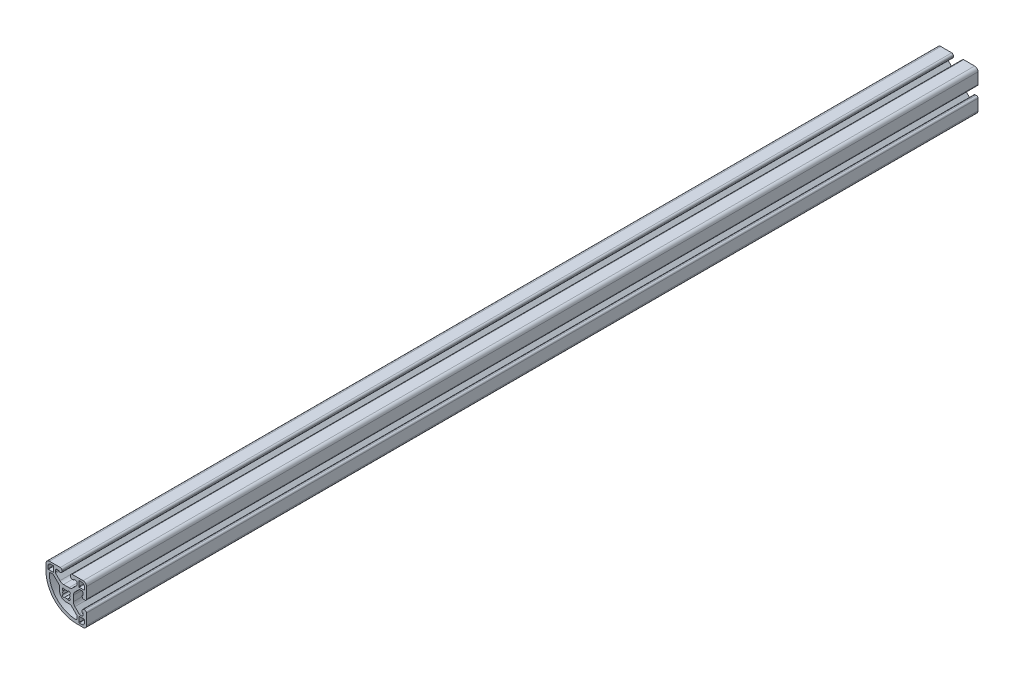
from build123d import *

# Parameters (mm, degrees)
BOSS_EXTRUDE1_DEPTH = 838.2


with BuildPart() as part:
    # Sketch1 → Boss-Extrude1 (new body)
    with BuildSketch(Plane.XY.offset(838.2)):
        with BuildLine():
            Line((-19.05, 15.875), (-19.05, 9.525))
            ThreePointArc((-19.05, 9.525), (-10.680576272, -10.680576272), (9.525, -19.05))
            Line((9.525, -19.05), (15.875, -19.05))
            ThreePointArc((15.875, -19.05), (18.12006403, -18.12006403), (19.05, -15.875))
            Line((19.05, -15.875), (19.05, -5.6388))
            ThreePointArc((19.05, -5.6388), (18.588751759, -4.525248241), (17.4752, -4.064))
            Line((17.4752, -4.064), (16.5608, -4.064))
            ThreePointArc((16.5608, -4.064), (15.447248241, -4.525248241), (14.986, -5.6388))
            Line((14.986, -5.6388), (14.986, -6.476993142))
            ThreePointArc((14.986, -6.476993142), (15.097592316, -6.746400826), (15.367, -6.857993142))
            Line((15.367, -6.857993142), (15.44319365, -6.857993142))
            ThreePointArc((15.44319365, -6.857993142), (15.712601334, -6.969585458), (15.82419365, -7.238993142))
            Line((15.82419365, -7.238993142), (15.82419365, -9.017))
            ThreePointArc((15.82419365, -9.017), (15.452219262, -9.915025612), (14.55419365, -10.287))
            Line((14.55419365, -10.287), (12.968312693, -10.287))
            ThreePointArc((12.968312693, -10.287), (12.482304734, -10.190327006), (12.070287081, -9.915025612))
            Line((12.070287081, -9.915025612), (8.122184211, -5.966922742))
            ThreePointArc((8.122184211, -5.966922742), (7.092556996, -4.425976719), (6.731, -2.608306952))
            Line((6.731, -2.608306952), (6.731, 2.608306952))
            ThreePointArc((6.731, 2.608306952), (7.092556996, 4.425976719), (8.122184211, 5.966922742))
            Line((8.122184211, 5.966922742), (12.070287081, 9.915025612))
            ThreePointArc((12.070287081, 9.915025612), (12.482304734, 10.190327006), (12.968312693, 10.287))
            Line((12.968312693, 10.287), (14.55419365, 10.287))
            ThreePointArc((14.55419365, 10.287), (15.452219262, 9.915025612), (15.82419365, 9.017))
            Line((15.82419365, 9.017), (15.82419365, 7.238993142))
            ThreePointArc((15.82419365, 7.238993142), (15.712601334, 6.969585458), (15.44319365, 6.857993142))
            Line((15.44319365, 6.857993142), (15.367, 6.857993142))
            ThreePointArc((15.367, 6.857993142), (15.097592316, 6.746400826), (14.986, 6.476993142))
            Line((14.986, 6.476993142), (14.986, 5.6388))
            ThreePointArc((14.986, 5.6388), (15.447248241, 4.525248241), (16.5608, 4.064))
            Line((16.5608, 4.064), (17.4752, 4.064))
            ThreePointArc((17.4752, 4.064), (18.588751759, 4.525248241), (19.05, 5.6388))
            Line((19.05, 5.6388), (19.05, 15.875))
            ThreePointArc((19.05, 15.875), (18.12006403, 18.12006403), (15.875, 19.05))
            Line((15.875, 19.05), (5.6388, 19.05))
            ThreePointArc((5.6388, 19.05), (4.525248241, 18.588751759), (4.064, 17.4752))
            Line((4.064, 17.4752), (4.064, 16.5608))
            ThreePointArc((4.064, 16.5608), (4.525248241, 15.447248241), (5.6388, 14.986))
            Line((5.6388, 14.986), (6.476993142, 14.986))
            ThreePointArc((6.476993142, 14.986), (6.746400826, 15.097592316), (6.857993142, 15.367))
            Line((6.857993142, 15.367), (6.857993142, 15.44319365))
            ThreePointArc((6.857993142, 15.44319365), (6.969585458, 15.712601334), (7.238993142, 15.82419365))
            Line((7.238993142, 15.82419365), (9.017, 15.82419365))
            ThreePointArc((9.017, 15.82419365), (9.915025612, 15.452219262), (10.287, 14.55419365))
            Line((10.287, 14.55419365), (10.287, 12.968312693))
            ThreePointArc((10.287, 12.968312693), (10.190327006, 12.482304734), (9.915025612, 12.070287081))
            Line((9.915025612, 12.070287081), (5.966922742, 8.122184211))
            ThreePointArc((5.966922742, 8.122184211), (4.425976719, 7.092556996), (2.608306952, 6.731))
            Line((2.608306952, 6.731), (-2.608306952, 6.731))
            ThreePointArc((-2.608306952, 6.731), (-4.425976719, 7.092556996), (-5.966922742, 8.122184211))
            Line((-5.966922742, 8.122184211), (-9.915025612, 12.070287081))
            ThreePointArc((-9.915025612, 12.070287081), (-10.190327006, 12.482304734), (-10.287, 12.968312693))
            Line((-10.287, 12.968312693), (-10.287, 14.55419365))
            ThreePointArc((-10.287, 14.55419365), (-9.915025612, 15.452219262), (-9.017, 15.82419365))
            Line((-9.017, 15.82419365), (-7.238993142, 15.82419365))
            ThreePointArc((-7.238993142, 15.82419365), (-6.969585458, 15.712601334), (-6.857993142, 15.44319365))
            Line((-6.857993142, 15.44319365), (-6.857993142, 15.367))
            ThreePointArc((-6.857993142, 15.367), (-6.746400826, 15.097592316), (-6.476993142, 14.986))
            Line((-6.476993142, 14.986), (-5.6388, 14.986))
            ThreePointArc((-5.6388, 14.986), (-4.525248241, 15.447248241), (-4.064, 16.5608))
            Line((-4.064, 16.5608), (-4.064, 17.4752))
            ThreePointArc((-4.064, 17.4752), (-4.525248241, 18.588751759), (-5.6388, 19.05))
            Line((-5.6388, 19.05), (-15.875, 19.05))
            ThreePointArc((-15.875, 19.05), (-18.12006403, 18.12006403), (-19.05, 15.875))
        make_face()
        with BuildLine():
            Line((-14.4526, 17.2466), (-12.2428, 17.2466))
            ThreePointArc((-12.2428, 17.2466), (-11.973392316, 17.135007684), (-11.8618, 16.8656))
            Line((-11.8618, 16.8656), (-11.8618, 12.2428))
            ThreePointArc((-11.8618, 12.2428), (-11.973392316, 11.973392316), (-12.2428, 11.8618))
            Line((-12.2428, 11.8618), (-16.8656, 11.8618))
            ThreePointArc((-16.8656, 11.8618), (-17.135007684, 11.973392316), (-17.2466, 12.2428))
            Line((-17.2466, 12.2428), (-17.2466, 14.4526))
            ThreePointArc((-17.2466, 14.4526), (-16.428256347, 16.428256347), (-14.4526, 17.2466))
        make_face(mode=Mode.SUBTRACT)
        with BuildLine():
            Line((-14.726680045, 10.287), (-12.804003164, 10.287))
            ThreePointArc((-12.804003164, 10.287), (-12.463797593, 10.219328904), (-12.175385236, 10.026617928))
            Line((-12.175385236, 10.026617928), (-6.696574388, 4.547807081))
            ThreePointArc((-6.696574388, 4.547807081), (-6.421272994, 4.135789428), (-6.3246, 3.649781469))
            Line((-6.3246, 3.649781469), (-6.3246, 0))
            ThreePointArc((-6.3246, 0), (-4.472167548, -4.472167548), (0, -6.3246))
            Line((0, -6.3246), (3.649781469, -6.3246))
            ThreePointArc((3.649781469, -6.3246), (4.135789428, -6.421272994), (4.547807081, -6.696574388))
            Line((4.547807081, -6.696574388), (10.026617928, -12.175385236))
            ThreePointArc((10.026617928, -12.175385236), (10.219328904, -12.463797593), (10.287, -12.804003164))
            Line((10.287, -12.804003164), (10.287, -14.726680045))
            ThreePointArc((10.287, -14.726680045), (9.905572448, -15.634060343), (8.990403141, -15.996401513))
            ThreePointArc((8.990403141, -15.996401513), (-8.525314803, -8.525314803), (-15.996401513, 8.990403141))
            ThreePointArc((-15.996401513, 8.990403141), (-15.634060343, 9.905572448), (-14.726680045, 10.287))
        make_face(mode=Mode.SUBTRACT)
        with BuildLine():
            Line((-3.437208141, -1.820762039), (-3.017877069, -1.401430967))
            ThreePointArc((-3.017877069, -1.401430967), (-3.3274, 0), (-3.017877069, 1.401430967))
            Line((-3.017877069, 1.401430967), (-3.437208141, 1.820762039))
            ThreePointArc((-3.437208141, 1.820762039), (-3.437208141, 3.437208141), (-1.820762039, 3.437208141))
            Line((-1.820762039, 3.437208141), (-1.401430967, 3.017877069))
            ThreePointArc((-1.401430967, 3.017877069), (0, 3.3274), (1.401430967, 3.017877069))
            Line((1.401430967, 3.017877069), (1.820762039, 3.437208141))
            ThreePointArc((1.820762039, 3.437208141), (3.437208141, 3.437208141), (3.437208141, 1.820762039))
            Line((3.437208141, 1.820762039), (3.017877069, 1.401430967))
            ThreePointArc((3.017877069, 1.401430967), (3.3274, 0), (3.017877069, -1.401430967))
            Line((3.017877069, -1.401430967), (3.437208141, -1.820762039))
            ThreePointArc((3.437208141, -1.820762039), (3.437208141, -3.437208141), (1.820762039, -3.437208141))
            Line((1.820762039, -3.437208141), (1.401430967, -3.017877069))
            ThreePointArc((1.401430967, -3.017877069), (0, -3.3274), (-1.401430967, -3.017877069))
            Line((-1.401430967, -3.017877069), (-1.820762039, -3.437208141))
            ThreePointArc((-1.820762039, -3.437208141), (-3.437208141, -3.437208141), (-3.437208141, -1.820762039))
        make_face(mode=Mode.SUBTRACT)
        with BuildLine():
            Line((12.2428, 17.2466), (14.4526, 17.2466))
            ThreePointArc((14.4526, 17.2466), (16.428256347, 16.428256347), (17.2466, 14.4526))
            Line((17.2466, 14.4526), (17.2466, 12.2428))
            ThreePointArc((17.2466, 12.2428), (17.135007684, 11.973392316), (16.8656, 11.8618))
            Line((16.8656, 11.8618), (12.2428, 11.8618))
            ThreePointArc((12.2428, 11.8618), (11.973392316, 11.973392316), (11.8618, 12.2428))
            Line((11.8618, 12.2428), (11.8618, 16.8656))
            ThreePointArc((11.8618, 16.8656), (11.973392316, 17.135007684), (12.2428, 17.2466))
        make_face(mode=Mode.SUBTRACT)
        with BuildLine():
            Line((11.8618, -16.8656), (11.8618, -12.2428))
            ThreePointArc((11.8618, -12.2428), (11.973392316, -11.973392316), (12.2428, -11.8618))
            Line((12.2428, -11.8618), (16.8656, -11.8618))
            ThreePointArc((16.8656, -11.8618), (17.135007684, -11.973392316), (17.2466, -12.2428))
            Line((17.2466, -12.2428), (17.2466, -14.4526))
            ThreePointArc((17.2466, -14.4526), (16.428256347, -16.428256347), (14.4526, -17.2466))
            Line((14.4526, -17.2466), (12.2428, -17.2466))
            ThreePointArc((12.2428, -17.2466), (11.973392316, -17.135007684), (11.8618, -16.8656))
        make_face(mode=Mode.SUBTRACT)
    extrude(amount=-BOSS_EXTRUDE1_DEPTH)


solid = part.part
